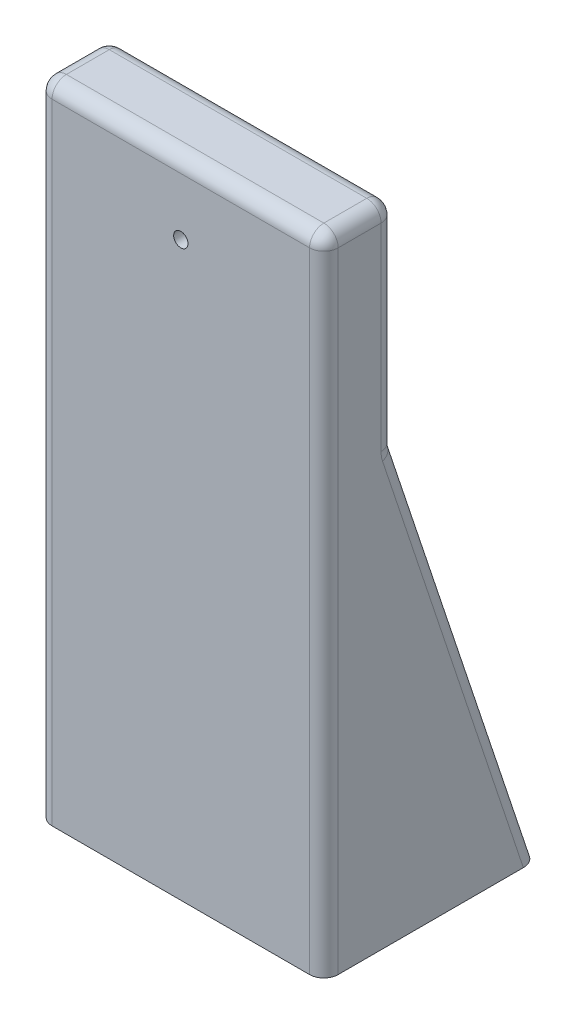
from build123d import *

# Parameters (mm, degrees)
SKETCH1_W           = 50.8
SKETCH1_H           = 114.3
SKETCH1_R           = 1.27
BOSS_EXTRUDE1_DEPTH = 6.35
BOSS_EXTRUDE2_DEPTH = 50.8
SKETCH2_R           = 1.5
CUT_EXTRUDE1_DEPTH  = 12.7
FILLET1_R           = 2.54


with BuildPart() as part:
    # Sketch1 → Boss-Extrude1 (new, symmetric)
    with BuildSketch(Plane.XY):
        Rectangle(SKETCH1_W, SKETCH1_H)
        with Locations((0, 44.45)):
            Circle(SKETCH1_R, mode=Mode.SUBTRACT)
    extrude(amount=BOSS_EXTRUDE1_DEPTH, both=True)

    # Sketch3 → Boss-Extrude2 (add, through all)
    with BuildSketch(Plane(origin=(25.4, 0, 0), x_dir=(0, 0, -1), z_dir=(1, 0, 0))):
        Polygon((6.35, -57.15), (31.75, -57.15), (6.35, 19.05), align=None)
    extrude(amount=-BOSS_EXTRUDE2_DEPTH)

    # Sketch2 → Cut-Extrude1 (cut)
    with BuildSketch(Plane.XZ.offset(57.15)):
        with Locations(Location((-15.24, 0, 0), (0, 0, 270))):
            Circle(SKETCH2_R)
        with Locations(Location((15.24, 0, 0), (0, 0, 270))):
            Circle(SKETCH2_R)
        with Locations(Location((-15.24, -22.86, 0), (0, 0, 270))):
            Circle(SKETCH2_R)
        with Locations(Location((15.24, -22.86, 0), (0, 0, 270))):
            Circle(SKETCH2_R)
    extrude(amount=-CUT_EXTRUDE1_DEPTH, mode=Mode.SUBTRACT)

    # Fillet1
    fillet1_edges = [part.edges().sort_by_distance(p)[0] for p in [
        (-25.4, 0, 6.35),
        (25.4, 38.1, -6.35),
        (-25.4, -19.05, -19.05),
        (0, 19.05, -6.35),
        (25.4, -19.05, -19.05),
        (25.4, 0, 6.35),
        (-25.4, 38.1, -6.35),
        (0, 57.15, -6.35),
        (-25.4, 57.15, 0),
        (25.4, 57.15, 0),
        (0, 57.15, 6.35),
    ]]
    fillet(fillet1_edges, radius=FILLET1_R)


solid = part.part
